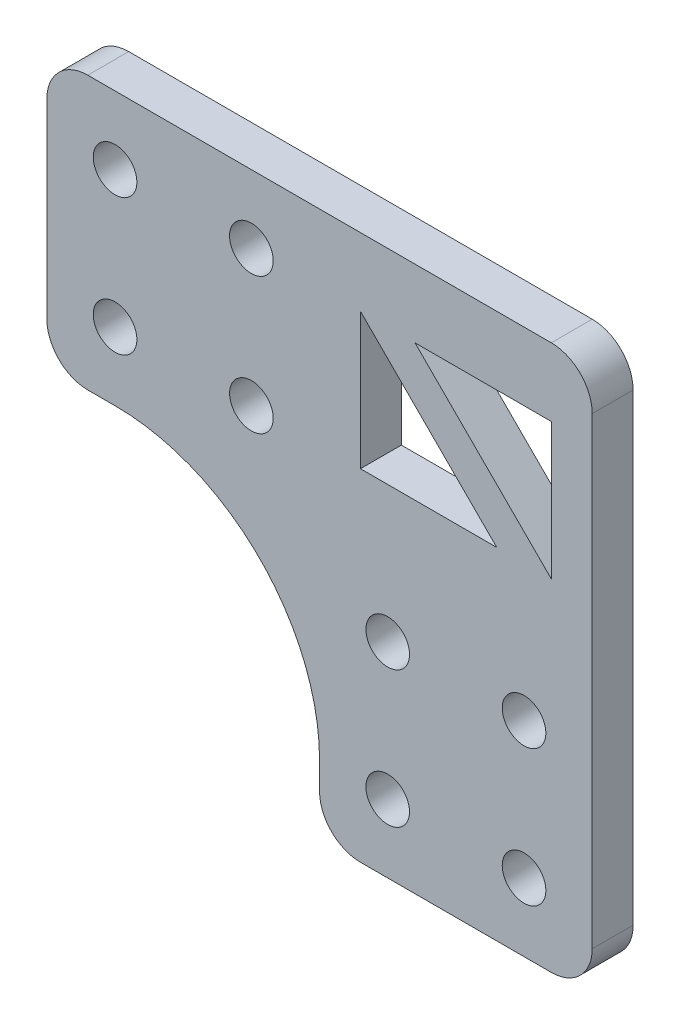
from build123d import *

# Parameters (mm, degrees)
SKETCH_1_R      = 1.6
EXTRUDE_1_DEPTH = 3
FILLET_1_R      = 3
FILLET_2_R      = 15


with BuildPart() as part:
    # 草图1 → 凸台-拉伸1 (new body)
    with BuildSketch(Plane.XY):
        Polygon((0, 0), (40, 0), (40, -40), (20, -40), (20, -20), (0, -20), align=None)
        with Locations((5, -5)):
            Circle(SKETCH_1_R, mode=Mode.SUBTRACT)
        with Locations(Location((15, -5, 0), (0, 0, 180))):
            Circle(SKETCH_1_R, mode=Mode.SUBTRACT)
        with Locations((15, -15)):
            Circle(SKETCH_1_R, mode=Mode.SUBTRACT)
        with Locations(Location((5, -15, 0), (0, 0, 180))):
            Circle(SKETCH_1_R, mode=Mode.SUBTRACT)
        with Locations((25, -35)):
            Circle(SKETCH_1_R, mode=Mode.SUBTRACT)
        with Locations(Location((35, -35, 0), (0, 0, 180))):
            Circle(SKETCH_1_R, mode=Mode.SUBTRACT)
        with Locations((35, -25)):
            Circle(SKETCH_1_R, mode=Mode.SUBTRACT)
        with Locations(Location((25, -25, 0), (0, 0, 180))):
            Circle(SKETCH_1_R, mode=Mode.SUBTRACT)
        Polygon((23, -5), (23, -15), (33, -15), align=None, mode=Mode.SUBTRACT)
        Polygon((27, -5), (37, -5), (37, -15), align=None, mode=Mode.SUBTRACT)
    extrude(amount=EXTRUDE_1_DEPTH)

    # 圆角1
    fillet_1_edges = [part.edges().sort_by_distance(p)[0] for p in [
        (0, 0, 1.5),
        (40, 0, 1.5),
        (40, -40, 1.5),
        (20, -40, 1.5),
        (0, -20, 1.5),
    ]]
    fillet(fillet_1_edges, radius=FILLET_1_R)

    # 圆角2
    fillet_2_edges = [part.edges().sort_by_distance(p)[0] for p in [
        (20, -20, 1.5),
    ]]
    fillet(fillet_2_edges, radius=FILLET_2_R)


solid = part.part
